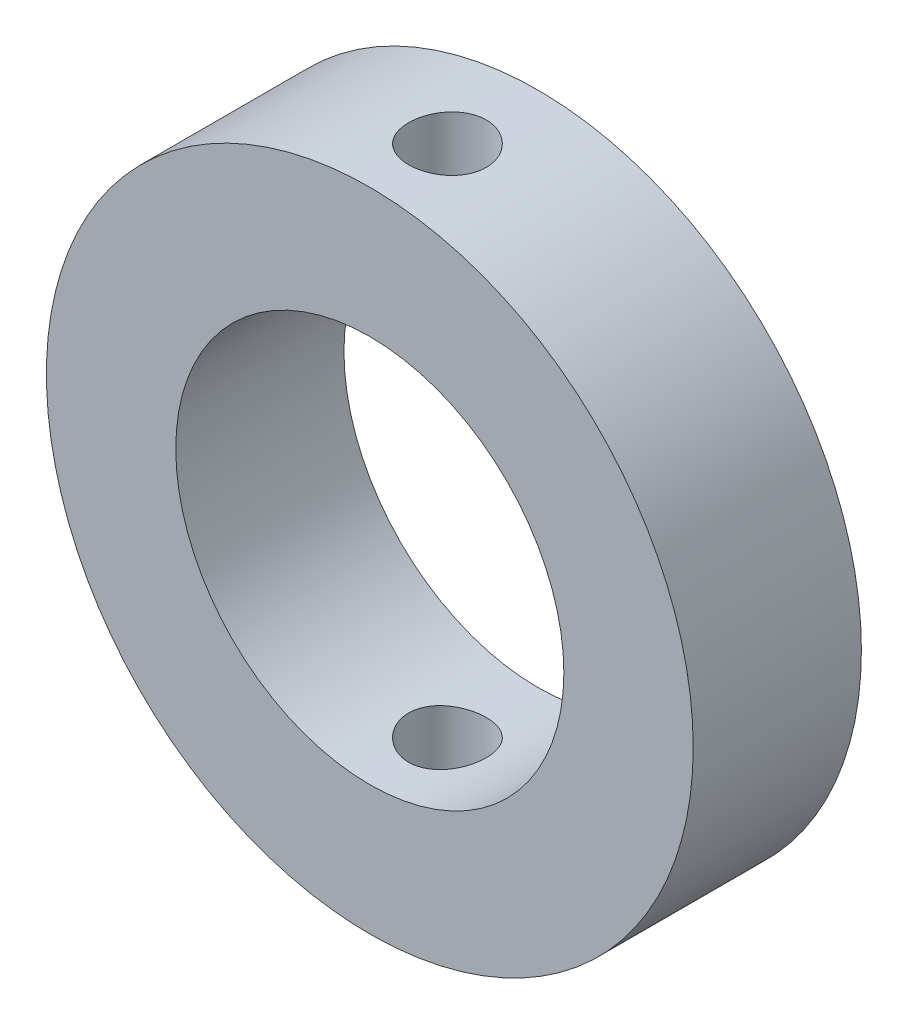
from build123d import *

# Parameters (mm, degrees)
SKETCH1_R           = 25
SKETCH1_R_2         = 15
BOSS_EXTRUDE1_DEPTH = 13
SKETCH2_R           = 3
CUT_EXTRUDE1_DEPTH  = 41.5


with BuildPart() as part:
    # Sketch1 → Boss-Extrude1 (new body)
    with BuildSketch(Plane.XY):
        with Locations(Location((0, 0, 0), (0, 0, 180))):
            Circle(SKETCH1_R)
        with Locations(Location((0, 0, 0), (0, 0, 180))):
            Circle(SKETCH1_R_2, mode=Mode.SUBTRACT)
    extrude(amount=BOSS_EXTRUDE1_DEPTH)

    # Sketch2 → Cut-Extrude1 (cut, symmetric)
    with BuildSketch(Plane(origin=(0, 0, 0), x_dir=(1, 0, 0), z_dir=(0, 1, 0))):
        with Locations(Location((0, -7, 0), (0, 0, 270))):
            Circle(SKETCH2_R)
    extrude(amount=CUT_EXTRUDE1_DEPTH, both=True, mode=Mode.SUBTRACT)


solid = part.part
